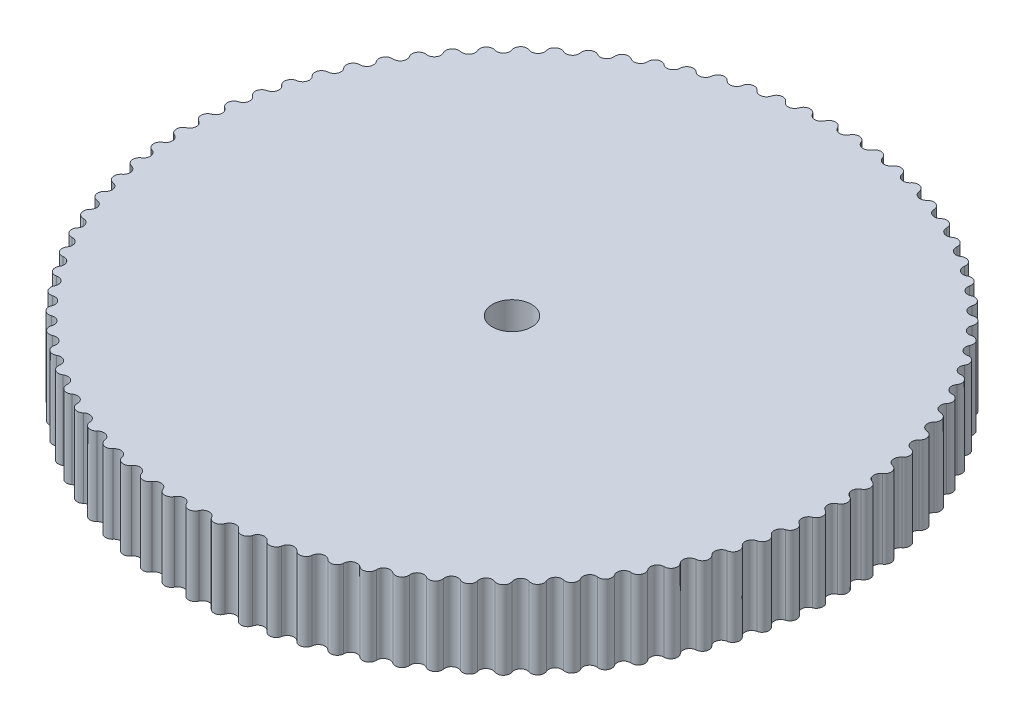
from build123d import *

# Parameters (mm, degrees)
BOSS_EXTRUDE1_DEPTH = 5
CIRPATTERN1_COUNT   = 84


with BuildPart() as part:
    # Sketch1 → Boss-Extrude1 (new body)
    with BuildSketch(Plane(origin=(0, 0, 0), x_dir=(1, 0, 0), z_dir=(0, 1, 0))):
        with BuildLine():
            Line((0, 20.75), (0, 1.25))
            ThreePointArc((0, 1.25), (0.046738993, 1.249125881), (0.093412617, 1.246504746))
            Line((0.093412617, 1.246504746), (1.550649442, 20.691978792))
            ThreePointArc((1.550649442, 20.691978792), (1.177479392, 20.966963115), (0.775867281, 20.735489624))
            ThreePointArc((0.775867281, 20.735489624), (0.383326762, 20.496415799), (0, 20.75))
        make_face()
    boss_extrude1 = extrude(amount=BOSS_EXTRUDE1_DEPTH)

    # CirPattern1: Boss-Extrude1 ×84 about axis
    cirpattern1_axis = Axis((0, 0, 0), (0, 1, 0))
    for i in range(1, CIRPATTERN1_COUNT):
        add(boss_extrude1.rotate(cirpattern1_axis, i * 360 / CIRPATTERN1_COUNT))


solid = part.part
